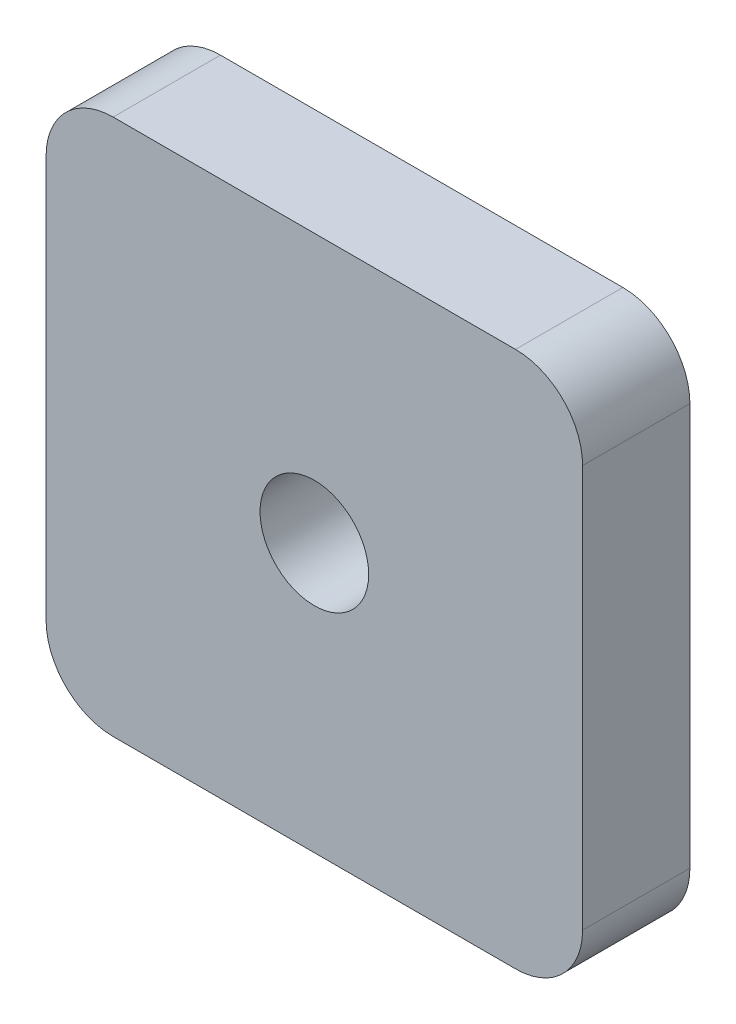
from build123d import *

# Parameters (mm, degrees)
SKETCH1_W           = 40
SKETCH1_H           = 40
SKETCH1_R           = 4.05
BOSS_EXTRUDE1_DEPTH = 8
FILLET1_R           = 5


with BuildPart() as part:
    # Sketch1 → Boss-Extrude1 (new body)
    with BuildSketch(Plane.XY):
        Rectangle(SKETCH1_W, SKETCH1_H)
        Circle(SKETCH1_R, mode=Mode.SUBTRACT)
    extrude(amount=BOSS_EXTRUDE1_DEPTH)

    # Fillet1
    fillet1_edges = [part.edges().sort_by_distance(p)[0] for p in [
        (20, -20, 4),
        (-20, -20, 4),
        (-20, 20, 4),
        (20, 20, 4),
    ]]
    fillet(fillet1_edges, radius=FILLET1_R)


solid = part.part
